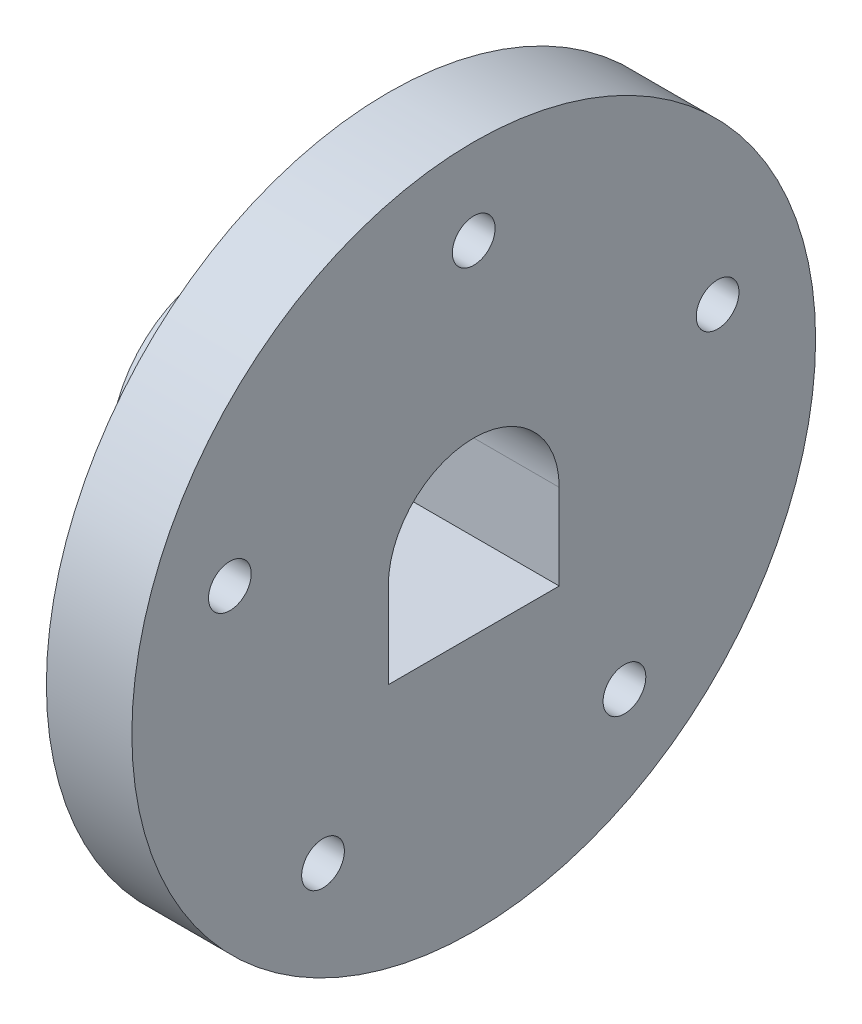
from build123d import *

# Parameters (mm, degrees)
SKETCH2_R           = 4
BOSS_EXTRUDE1_DEPTH = 1
SKETCH4_R           = 1
CUT_EXTRUDE1_DEPTH  = 2.5
SKETCH5_R           = 0.25
CUT_EXTRUDE2_DEPTH  = 2
CIRPATTERN1_COUNT   = 5
CUT_EXTRUDE3_DEPTH  = 6.744562647
BOSS_EXTRUDE2_DEPTH = 2


with BuildPart() as part:
    # Sketch2 → Boss-Extrude1 (new body)
    with BuildSketch(Plane(origin=(0, 0, 0), x_dir=(0, 0, -1), z_dir=(1, 0, 0))):
        Circle(SKETCH2_R)
    extrude(amount=-BOSS_EXTRUDE1_DEPTH)

    # Sketch4 → Cut-Extrude1 (cut)
    with BuildSketch(Plane(origin=(0, 0, 0), x_dir=(0, 0, -1), z_dir=(1, 0, 0))):
        Circle(SKETCH4_R)
    extrude(amount=-CUT_EXTRUDE1_DEPTH, mode=Mode.SUBTRACT)

    # Sketch5 → Cut-Extrude2 (cut)
    with BuildSketch(Plane(origin=(0, 0, 0), x_dir=(0, 0, -1), z_dir=(1, 0, 0))):
        with Locations((0, 3)):
            Circle(SKETCH5_R)
    cut_extrude2 = extrude(amount=-CUT_EXTRUDE2_DEPTH, mode=Mode.SUBTRACT)

    # CirPattern1: Cut-Extrude2 ×5 about axis
    cirpattern1_axis = Axis((-2.5, 0, 0), (1, 0, 0))
    for i in range(1, CIRPATTERN1_COUNT):
        add(cut_extrude2.rotate(cirpattern1_axis, i * 360 / CIRPATTERN1_COUNT), mode=Mode.SUBTRACT)

    # Sketch6 → Cut-Extrude3 (cut, through all)
    with BuildSketch(Plane.ZY.offset(1)):
        with BuildLine():
            Line((-1, -1), (0, -1))
            ThreePointArc((0, -1), (-0.707106781, -0.707106781), (-1, 0))
            Line((-1, 0), (-1, -1))
        make_face()
        with BuildLine():
            Line((0, -1), (1, -1))
            Line((1, -1), (1, 0))
            ThreePointArc((1, 0), (0.707106781, -0.707106781), (0, -1))
        make_face()
    extrude(amount=-CUT_EXTRUDE3_DEPTH, mode=Mode.SUBTRACT)

    # Sketch6<3> → Boss-Extrude2 (add)
    with BuildSketch(Plane.ZY.offset(1)):
        with BuildLine():
            Line((-1.25, -1.25), (1.25, -1.25))
            Line((1.25, -1.25), (1.25, 0))
            ThreePointArc((1.25, 0), (0, 1.25), (-1.25, 0))
            Line((-1.25, 0), (-1.25, -1.25))
        make_face()
        with BuildLine():
            Line((-1, -1), (-1, 0))
            ThreePointArc((-1, 0), (0, 1), (1, 0))
            Line((1, 0), (1, -1))
            Line((1, -1), (-1, -1))
        make_face(mode=Mode.SUBTRACT)
    extrude(amount=BOSS_EXTRUDE2_DEPTH)


solid = part.part
